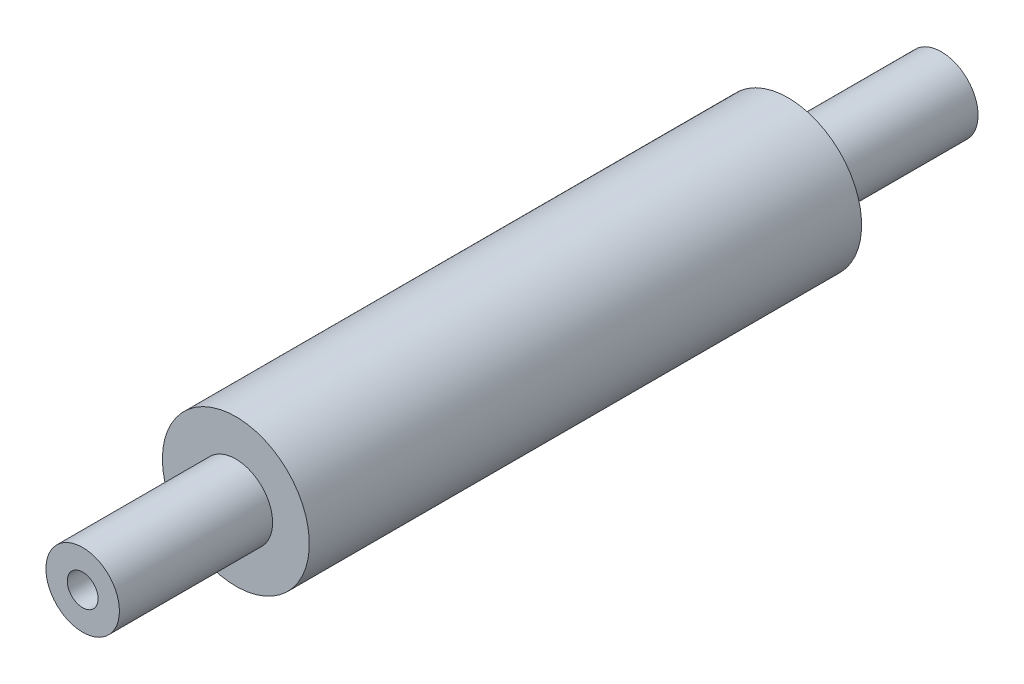
from build123d import *

# Parameters (mm, degrees)
CROQUIS1_R              = 9.525
SALIENTE_EXTRUIR1_DEPTH = 71.6
CROQUIS2_R              = 4.7625
SALIENTE_EXTRUIR2_DEPTH = 19.86
SALIENTE_EXTRUIR3_START = 19.86
CROQUIS3_R              = 4.7625
SALIENTE_EXTRUIR3_DEPTH = 19.86
CROQUIS4_R              = 2
CORTAR_EXTRUIR1_DEPTH   = 5
CORTAR_EXTRUIR2_START   = -5
CROQUIS5_R              = 2
CORTAR_EXTRUIR2_DEPTH   = 5


with BuildPart() as part:
    # Croquis1 → Saliente-Extruir1 (new body)
    with BuildSketch(Plane.XY):
        with Locations(Location((0, 0, 0), (0, 0, 180))):
            Circle(CROQUIS1_R)
    extrude(amount=SALIENTE_EXTRUIR1_DEPTH)

    # Croquis2 → Saliente-Extruir2 (add)
    with BuildSketch(Plane.XY.offset(71.6)):
        Circle(CROQUIS2_R)
    extrude(amount=SALIENTE_EXTRUIR2_DEPTH)

    # Croquis3 → Saliente-Extruir3 (add)
    with BuildSketch(Plane(origin=(0, 0, 0), x_dir=(-1, 0, 0), z_dir=(0, 0, -1)).offset(SALIENTE_EXTRUIR3_START)):
        with Locations(Location((0, 0, 0), (0, 0, 180))):
            Circle(CROQUIS3_R)
    extrude(amount=-SALIENTE_EXTRUIR3_DEPTH)

    # Croquis4 → Cortar-Extruir1 (cut)
    with BuildSketch(Plane(origin=(0, 0, -19.86), x_dir=(-1, 0, 0), z_dir=(0, 0, -1))):
        Circle(CROQUIS4_R)
    extrude(amount=-CORTAR_EXTRUIR1_DEPTH, mode=Mode.SUBTRACT)

    # Croquis5 → Cortar-Extruir2 (cut)
    with BuildSketch(Plane.XY.offset(91.46).offset(CORTAR_EXTRUIR2_START)):
        with Locations(Location((0, 0, 0), (0, 0, 180))):
            Circle(CROQUIS5_R)
    extrude(amount=CORTAR_EXTRUIR2_DEPTH, mode=Mode.SUBTRACT)


solid = part.part
